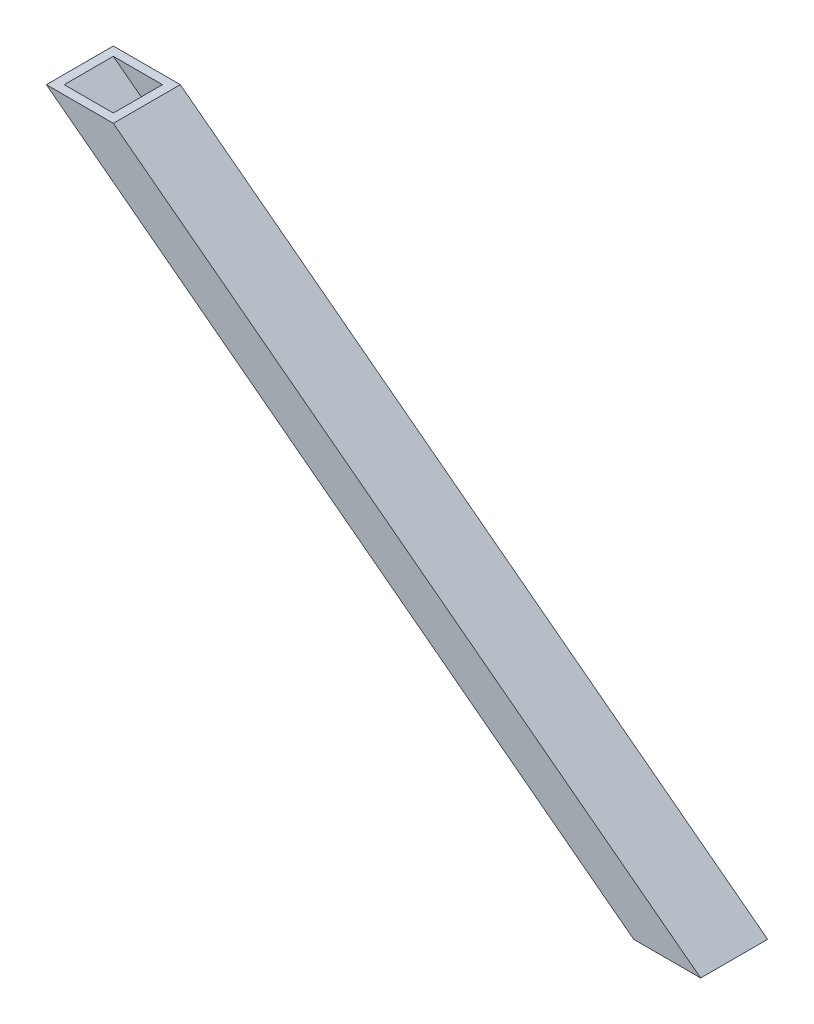
from build123d import *

# Parameters (mm, degrees)
SKETCH3_W           = 75
SKETCH3_H           = 75
SKETCH3_W_2         = 55
SKETCH3_H_2         = 55
BOSS_EXTRUDE2_DEPTH = 826.205


with BuildPart() as part:
    # Sketch3 → Boss-Extrude2 (new, along a direction that is not the sketch's normal)
    with BuildSketch(Plane(origin=(0, 0, 0), x_dir=(1, 0, 0), z_dir=(0, 1, 0))):
        Rectangle(SKETCH3_W, SKETCH3_H)
        Rectangle(SKETCH3_W_2, SKETCH3_H_2, mode=Mode.SUBTRACT)
    extrude(amount=-BOSS_EXTRUDE2_DEPTH, dir=(-0.7960914026765946, 0.6051764028648275, 0))


solid = part.part
